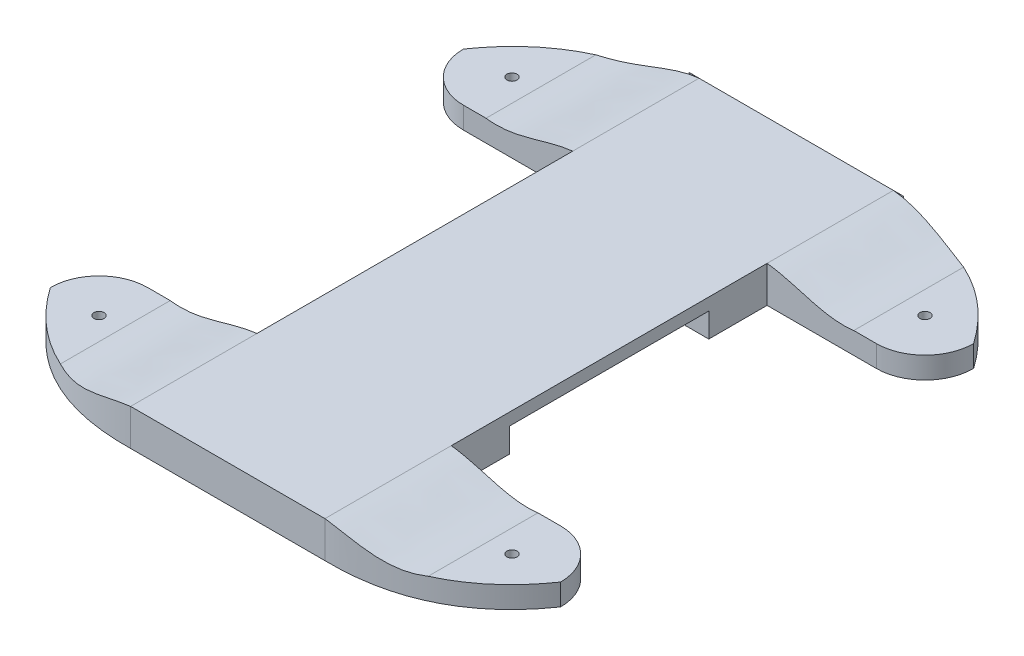
from build123d import *

# Parameters (mm, degrees)
SKETCH1_R           = 2.1
BOSS_EXTRUDE1_DEPTH = 15
SKETCH2_W           = 82
SKETCH2_H           = 82
CUT_EXTRUDE1_DEPTH  = 10
CUT_EXTRUDE2_DEPTH  = 257.934619876


with BuildPart() as part:
    # Sketch1 → Boss-Extrude1 (new body)
    with BuildSketch(Plane(origin=(0, 0, 0), x_dir=(1, 0, 0), z_dir=(0, 1, 0))):
        with BuildLine():
            Line((-40, 117), (40, 117))
            add(Edge.make_bspline(
                [(105, 85), (82.19875176, 117.821973651), (40, 117)],
                knots=[0, 0, 0, 1, 1, 1], degree=2))
            ThreePointArc((105, 85), (99.142135624, 70.857864376), (85, 65))
            Line((85, 65), (40, 65))
            Line((40, 65), (40, -65))
            Line((40, -65), (85, -65))
            ThreePointArc((85, -65), (99.142135624, -70.857864376), (105, -85))
            add(Edge.make_bspline(
                [(105, -85), (82.19875176, -117.821973651), (40, -117)],
                knots=[0, 0, 0, 1, 1, 1], degree=2))
            Line((40, -117), (-40, -117))
            add(Edge.make_bspline(
                [(-105, -85), (-82.19875176, -117.821973651), (-40, -117)],
                knots=[0, 0, 0, 1, 1, 1], degree=2))
            ThreePointArc((-105, -85), (-99.142135624, -70.857864376), (-85, -65))
            Line((-85, -65), (-40, -65))
            Line((-40, -65), (-40, 65))
            Line((-40, 65), (-85, 65))
            ThreePointArc((-85, 65), (-99.142135624, 70.857864376), (-105, 85))
            add(Edge.make_bspline(
                [(-105, 85), (-82.19875176, 117.821973651), (-40, 117)],
                knots=[0, 0, 0, 1, 1, 1], degree=2))
        make_face()
        with Locations(Location((-85, 85, 0), (0, 0, 270))):
            Circle(SKETCH1_R, mode=Mode.SUBTRACT)
        with Locations(Location((85, 85, 0), (0, 0, 90))):
            Circle(SKETCH1_R, mode=Mode.SUBTRACT)
        with Locations(Location((-85, -85, 0), (0, 0, 90))):
            Circle(SKETCH1_R, mode=Mode.SUBTRACT)
        with Locations(Location((85, -85, 0), (0, 0, 270))):
            Circle(SKETCH1_R, mode=Mode.SUBTRACT)
    extrude(amount=BOSS_EXTRUDE1_DEPTH)

    # Sketch2 → Cut-Extrude1 (cut)
    with BuildSketch(Plane.XZ):
        Rectangle(SKETCH2_W, SKETCH2_H)
    extrude(amount=-CUT_EXTRUDE1_DEPTH, mode=Mode.SUBTRACT)

    # Sketch3 → Cut-Extrude2 (cut, through all)
    with BuildSketch(Plane(origin=(0, 0, -117), x_dir=(-1, 0, 0), z_dir=(0, 0, -1))):
        with BuildLine():
            Line((-75.688086791, 8.8904517), (-105, 8.8904517))
            Line((-105, 8.8904517), (-105, 15))
            Line((-105, 15), (-40, 15))
            add(Edge.make_bspline(
                [(-75.688086791, 8.8904517), (-63.128326114, 7.187324041), (-52.082553879, 13.673406614), (-40, 15)],
                knots=[0, 0, 0, 0, 1, 1, 1, 1], degree=3))
        make_face()
        with BuildLine():
            Line((105, 15), (40, 15))
            add(Edge.make_bspline(
                [(75.688086791, 8.8904517), (63.128326114, 7.187324041), (52.082553879, 13.673406614), (40, 15)],
                knots=[0, 0, 0, 0, 1, 1, 1, 1], degree=3))
            Line((75.688086791, 8.8904517), (105, 8.8904517))
            Line((105, 8.8904517), (105, 15))
        make_face()
    extrude(amount=-CUT_EXTRUDE2_DEPTH, mode=Mode.SUBTRACT)


solid = part.part
